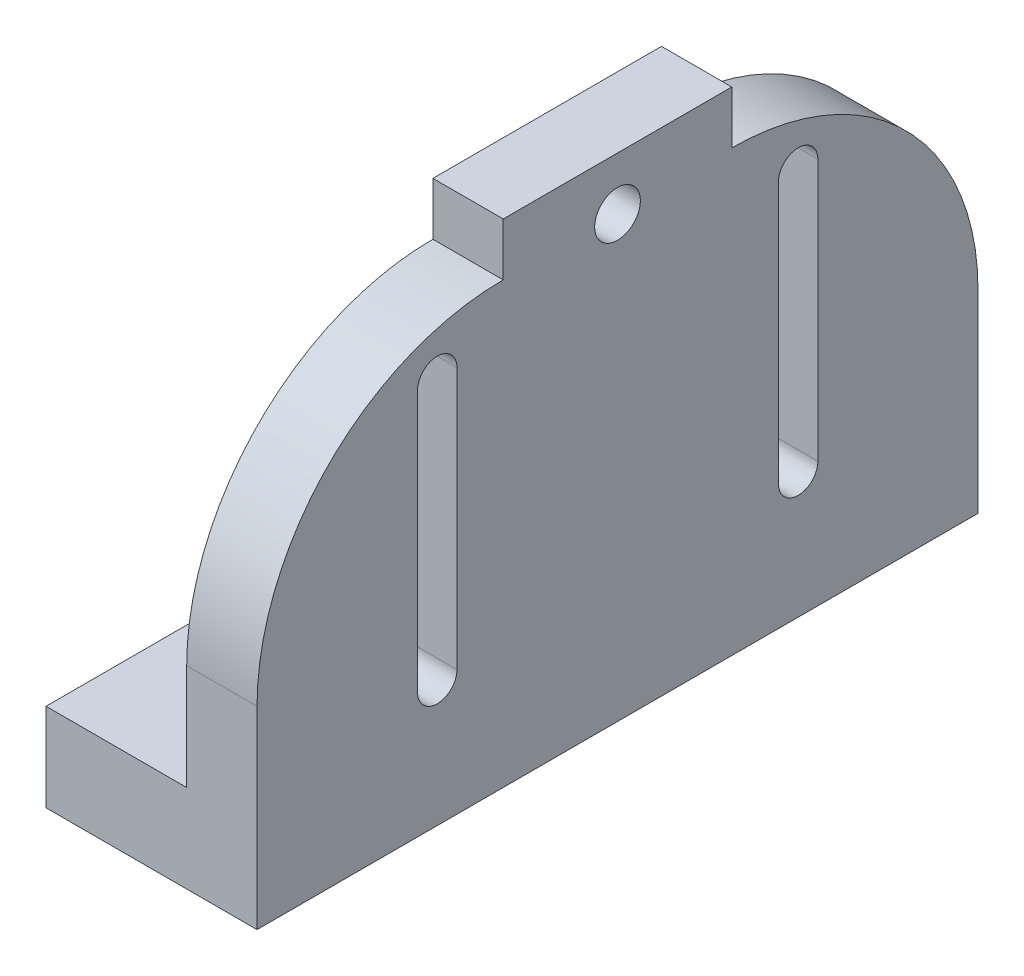
from build123d import *

# Parameters (mm, degrees)
SKETCH1_W           = 15.24
SKETCH1_H           = 52.07
BOSS_EXTRUDE1_DEPTH = 6.35
SKETCH2_W           = 5.08
SKETCH2_H           = 52.07
BOSS_EXTRUDE2_DEPTH = 25.4
CUT_EXTRUDE1_DEPTH  = 8.382
SKETCH4_R           = 1.651
CUT_EXTRUDE2_DEPTH  = 8.382
FILLET1_R           = 17.78
SKETCH6_W           = 5.08
SKETCH6_H           = 16.51
BOSS_EXTRUDE3_DEPTH = 3.81
SKETCH7_R           = 1.651
CUT_EXTRUDE3_DEPTH  = 14.478


with BuildPart() as part:
    # Sketch1 → Boss-Extrude1 (new body)
    with BuildSketch(Plane(origin=(0, 0, 0), x_dir=(1, 0, 0), z_dir=(0, 1, 0))):
        with Locations((7.62, 26.035)):
            Rectangle(SKETCH1_W, SKETCH1_H)
    extrude(amount=BOSS_EXTRUDE1_DEPTH)

    # Sketch2 → Boss-Extrude2 (add)
    with BuildSketch(Plane(origin=(0, 6.35, 0), x_dir=(1, 0, 0), z_dir=(0, 1, 0))):
        with Locations((12.7, 26.035)):
            Rectangle(SKETCH2_W, SKETCH2_H)
    extrude(amount=BOSS_EXTRUDE2_DEPTH)

    # Sketch3 → Cut-Extrude1 (cut)
    with BuildSketch(Plane(origin=(15.24, 0, 0), x_dir=(0, 0, -1), z_dir=(1, 0, 0))):
        with BuildLine():
            Line((14.4399, 27.94), (14.4399, 9.0424))
            ThreePointArc((14.4399, 9.0424), (13.0175, 7.62), (11.5951, 9.0424))
            Line((11.5951, 9.0424), (11.5951, 27.94))
            ThreePointArc((11.5951, 27.94), (13.0175, 29.3624), (14.4399, 27.94))
        make_face()
        with BuildLine():
            Line((40.50522627, 27.94), (40.50522627, 9.0424))
            ThreePointArc((40.50522627, 9.0424), (39.08282627, 7.62), (37.66042627, 9.0424))
            Line((37.66042627, 9.0424), (37.66042627, 27.94))
            ThreePointArc((37.66042627, 27.94), (39.08282627, 29.3624), (40.50522627, 27.94))
        make_face()
    extrude(amount=-CUT_EXTRUDE1_DEPTH, mode=Mode.SUBTRACT)

    # Sketch4 → Cut-Extrude2 (cut)
    with BuildSketch(Plane(origin=(0, 6.35, 0), x_dir=(1, 0, 0), z_dir=(0, 1, 0))):
        with Locations(Location((5.08, 38.735, 0), (0, 0, 270))):
            Circle(SKETCH4_R)
        with Locations(Location((5.08, 13.335, 0), (0, 0, 270))):
            Circle(SKETCH4_R)
    extrude(amount=-CUT_EXTRUDE2_DEPTH, mode=Mode.SUBTRACT)

    # Fillet1
    fillet1_edges = [part.edges().sort_by_distance(p)[0] for p in [
        (12.7, 31.75, -52.07),
        (12.7, 31.75, 0),
    ]]
    fillet(fillet1_edges, radius=FILLET1_R)

    # Sketch6 → Boss-Extrude3 (add)
    with BuildSketch(Plane(origin=(0, 31.75, 0), x_dir=(1, 0, 0), z_dir=(0, 1, 0))):
        with Locations((12.7, 26.035)):
            Rectangle(SKETCH6_W, SKETCH6_H)
    extrude(amount=BOSS_EXTRUDE3_DEPTH)

    # Sketch7 → Cut-Extrude3 (cut)
    with BuildSketch(Plane.ZY.offset(-10.16)):
        with Locations((-26.035, 31.75)):
            Circle(SKETCH7_R)
    extrude(amount=-CUT_EXTRUDE3_DEPTH, mode=Mode.SUBTRACT)


solid = part.part
